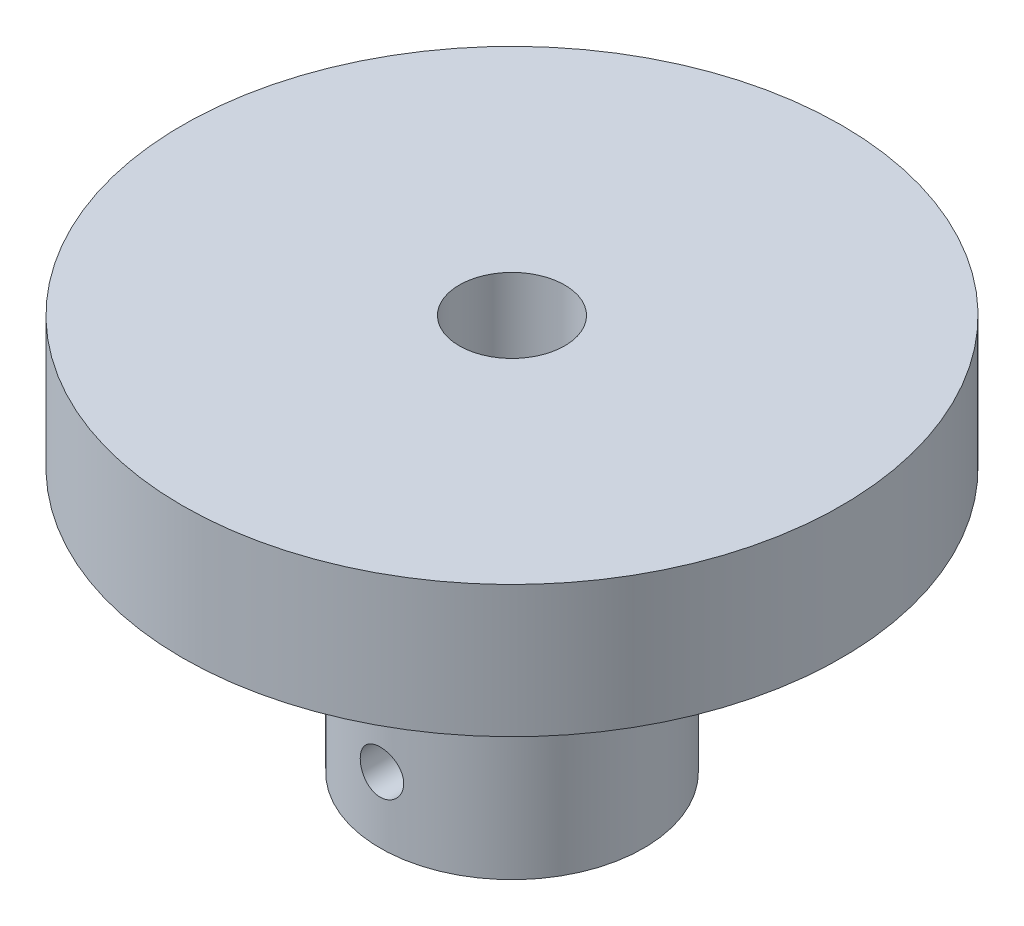
from build123d import *

# Parameters (mm, degrees)
SKETCH1_R                  = 25
BOSS_EXTRUDE1_DEPTH        = 30
CUT_EXTRUDE1_REACH         = 48.368
SKETCH2_R                  = 4
SKETCH3_OUTSIDE_W          = 67.362
SKETCH3_OUTSIDE_H          = 67.362
SKETCH3_OUTSIDE_R          = 10
CUT_EXTRUDE2_DEPTH         = 20
SKETCH4_W                  = 1.65
SKETCH4_H                  = 10
M4_TAPPED_HOLE1_AT_2_COUNT = 2
M4_TAPPED_HOLE1_AT_2_PITCH = 8
CHAMFER1_SIZE              = 1
FILLET1_R                  = 2


with BuildPart() as part:
    # Sketch1 → Boss-Extrude1 (new body)
    with BuildSketch(Plane(origin=(0, 0, 0), x_dir=(1, 0, 0), z_dir=(0, 1, 0))):
        with Locations(Location((0, 0, 0), (0, 0, 270))):
            Circle(SKETCH1_R)
    extrude(amount=BOSS_EXTRUDE1_DEPTH)

    # Sketch2 → Cut-Extrude1 (cut, up to next)
    with BuildSketch(Plane.XZ, mode=Mode.PRIVATE) as cut_extrude1_sk1:
        with Locations(Location((0, 0, 0), (0, 0, 270))):
            Circle(SKETCH2_R)
    cut_extrude1_tool1 = extrude(cut_extrude1_sk1.sketch, amount=-CUT_EXTRUDE1_REACH, mode=Mode.PRIVATE) & part.part
    add(cut_extrude1_tool1.solids().sort_by_distance((0, 0, 0))[0], mode=Mode.SUBTRACT)

    # Sketch3 outside → Cut-Extrude2 (cut)
    with BuildSketch(Plane.XZ):
        Rectangle(SKETCH3_OUTSIDE_W, SKETCH3_OUTSIDE_H)
        with Locations(Location((0, 0, 0), (0, 0, 270))):
            Circle(SKETCH3_OUTSIDE_R, mode=Mode.SUBTRACT)
    extrude(amount=-CUT_EXTRUDE2_DEPTH, mode=Mode.SUBTRACT)

    # Sketch4 → M4 Tapped Hole1 (revolve, cut)
    with BuildSketch(Plane(origin=(0, 5, 0), x_dir=(0, 1, 0), z_dir=(1, 0, 0))):
        with Locations((0.825, 5)):
            Rectangle(SKETCH4_W, SKETCH4_H)
    m4_tapped_hole1 = revolve(axis=Axis((0, 5, -6.35), (0, 0, 1)), mode=Mode.SUBTRACT)

    # M4 Tapped Hole1 at 2: M4 Tapped Hole1 ×2
    with Locations(*[(0, i * M4_TAPPED_HOLE1_AT_2_PITCH, 0) for i in range(1, M4_TAPPED_HOLE1_AT_2_COUNT)]):
        add(m4_tapped_hole1, mode=Mode.SUBTRACT)

    # Chamfer1
    chamfer1_edges = [part.edges().sort_by_distance(p)[0] for p in [
        (0, 0, 4),
    ]]
    chamfer(chamfer1_edges, length=CHAMFER1_SIZE)

    # Fillet1
    fillet1_edges = [part.edges().sort_by_distance(p)[0] for p in [
        (0, 20, 10),
    ]]
    fillet(fillet1_edges, radius=FILLET1_R)


solid = part.part
